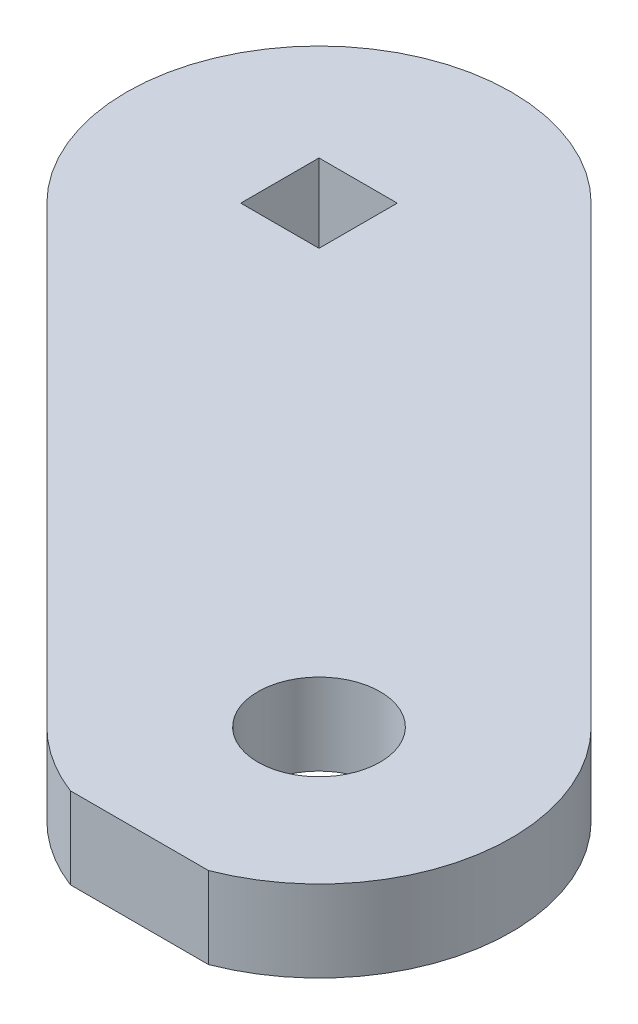
from build123d import *

# Parameters (mm, degrees)
SKETCH2_R           = 4.7625
SKETCH2_W           = 6.1
SKETCH2_H           = 6.1
BOSS_EXTRUDE1_DEPTH = 6.35


with BuildPart() as part:
    # Sketch2 → Boss-Extrude1 (new body)
    with BuildSketch(Plane(origin=(0, 0, 0), x_dir=(1, 0, 0), z_dir=(0, 1, 0))):
        with BuildLine():
            Line((45.961940777, -24.748737342), (10.606601718, 10.606601718))
            ThreePointArc((10.606601718, 10.606601718), (-10.606601718, 10.606601718), (-10.606601718, -10.606601718))
            Line((-10.606601718, -10.606601718), (24.748737342, -45.961940777))
            ThreePointArc((24.748737342, -45.961940777), (27.181420958, -47.93258291), (29.970174252, -49.355339059))
            Line((29.970174252, -49.355339059), (40.740503866, -49.355339059))
            ThreePointArc((40.740503866, -49.355339059), (50.028626393, -38.468960557), (45.961940777, -24.748737342))
        make_face()
        with Locations(Location((35.355339059, -35.355339059, 0), (0, 0, 270))):
            Circle(SKETCH2_R, mode=Mode.SUBTRACT)
        Rectangle(SKETCH2_W, SKETCH2_H, mode=Mode.SUBTRACT)
    extrude(amount=-BOSS_EXTRUDE1_DEPTH)


solid = part.part
